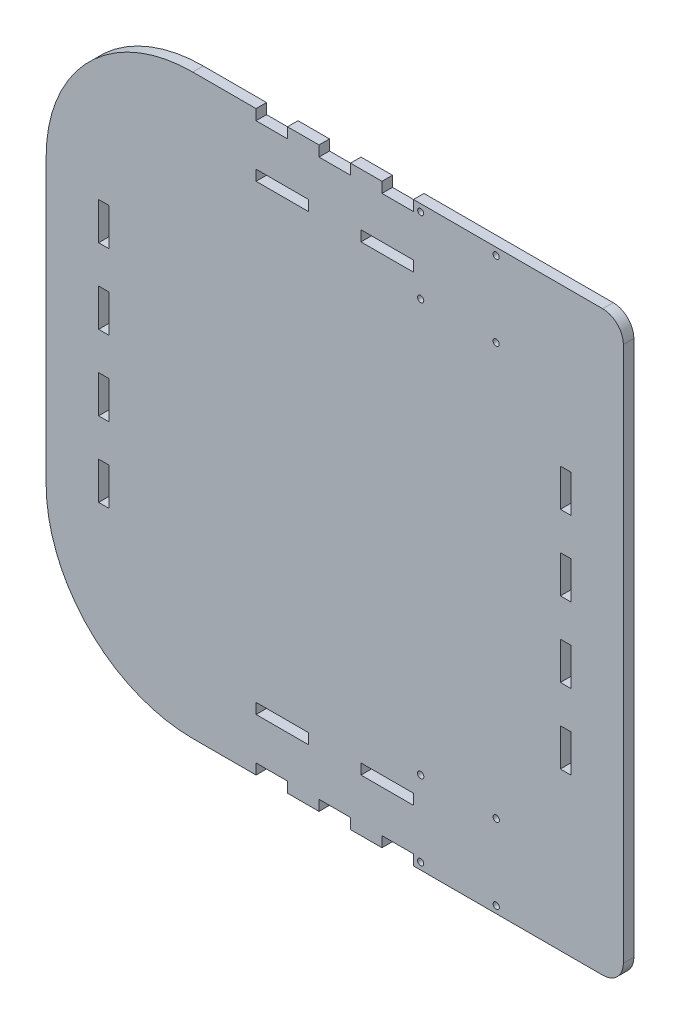
from build123d import *

# Parameters (mm, degrees)
SKETCH1_W           = 279.4
SKETCH1_H           = 279.4
BOSS_EXTRUDE1_DEPTH = 5.08
FILLET1_R           = 70.96
FILLET2_R           = 70.960000066
FILLET3_R           = 10
FILLET4_R           = 10
SKETCH2_W           = 25.4
SKETCH2_H           = 5.08
CUT_EXTRUDE1_DEPTH  = 7.62
SKETCH3_W           = 15.24
SKETCH3_H           = 5.08
CUT_EXTRUDE2_DEPTH  = 5.08
SKETCH4_W           = 25.4
SKETCH4_H           = 5.08
SKETCH4_W_2         = 15.24
CUT_EXTRUDE3_DEPTH  = 5.08
SKETCH5_W           = 5.08
SKETCH5_H           = 18.142857143
CUT_EXTRUDE4_DEPTH  = 5.08
SKETCH9_R           = 1.521747373
SKETCH9_R_2         = 1.52437788
SKETCH9_R_3         = 1.483080804
SKETCH9_R_4         = 1.509853377
CUT_EXTRUDE5_DEPTH  = 5.08
SKETCH10_R          = 1.496375704
SKETCH10_R_2        = 1.496038234
SKETCH10_R_3        = 1.499292219
SKETCH10_R_4        = 1.440705467
CUT_EXTRUDE6_DEPTH  = 5.08


with BuildPart() as part:
    # Sketch1 → Boss-Extrude1 (new body)
    with BuildSketch(Plane.XY):
        Rectangle(SKETCH1_W, SKETCH1_H)
    extrude(amount=BOSS_EXTRUDE1_DEPTH)

    # Fillet1
    fillet1_edges = [part.edges().sort_by_distance(p)[0] for p in [
        (-139.7, 139.7, 2.54),
    ]]
    fillet(fillet1_edges, radius=FILLET1_R)

    # Fillet2
    fillet2_edges = [part.edges().sort_by_distance(p)[0] for p in [
        (-139.7, -139.7, 2.54),
    ]]
    fillet(fillet2_edges, radius=FILLET2_R)

    # Fillet3
    fillet3_edges = [part.edges().sort_by_distance(p)[0] for p in [
        (139.7, 139.7, 2.54),
    ]]
    fillet(fillet3_edges, radius=FILLET3_R)

    # Fillet4
    fillet4_edges = [part.edges().sort_by_distance(p)[0] for p in [
        (139.7, -139.7, 2.54),
    ]]
    fillet(fillet4_edges, radius=FILLET4_R)

    # Sketch2 → Cut-Extrude1 (cut)
    with BuildSketch(Plane.XY.offset(5.08)):
        with Locations((-25.4, -111.76)):
            Rectangle(SKETCH2_W, SKETCH2_H)
        with Locations((25.4, -111.76)):
            Rectangle(SKETCH2_W, SKETCH2_H)
    extrude(amount=-CUT_EXTRUDE1_DEPTH, mode=Mode.SUBTRACT)

    # Sketch3 → Cut-Extrude2 (cut)
    with BuildSketch(Plane.XY.offset(5.08)):
        with Locations((-30.48, -137.16)):
            Rectangle(SKETCH3_W, SKETCH3_H)
        with Locations((0, -137.16)):
            Rectangle(SKETCH3_W, SKETCH3_H)
        with Locations((30.48, -137.16)):
            Rectangle(SKETCH3_W, SKETCH3_H)
    extrude(amount=-CUT_EXTRUDE2_DEPTH, mode=Mode.SUBTRACT)

    # Sketch4 → Cut-Extrude3 (cut)
    with BuildSketch(Plane.XY.offset(5.08)):
        with Locations((-25.4, 111.76)):
            Rectangle(SKETCH4_W, SKETCH4_H)
        with Locations((25.4, 111.76)):
            Rectangle(SKETCH4_W, SKETCH4_H)
        with Locations((-30.48, 137.16)):
            Rectangle(SKETCH4_W_2, SKETCH4_H)
        with Locations((0, 137.16)):
            Rectangle(SKETCH4_W_2, SKETCH4_H)
        with Locations((30.48, 137.16)):
            Rectangle(SKETCH4_W_2, SKETCH4_H)
    extrude(amount=-CUT_EXTRUDE3_DEPTH, mode=Mode.SUBTRACT)

    # Sketch5 → Cut-Extrude4 (cut)
    with BuildSketch(Plane(origin=(0, 0, 0), x_dir=(-1, 0, 0), z_dir=(0, 0, -1))):
        with Locations((111.76, -54.428571429)):
            Rectangle(SKETCH5_W, SKETCH5_H)
        with Locations((111.76, -18.142857143)):
            Rectangle(SKETCH5_W, SKETCH5_H)
        with Locations((111.76, 18.142857143)):
            Rectangle(SKETCH5_W, SKETCH5_H)
        with Locations((111.76, 54.428571429)):
            Rectangle(SKETCH5_W, SKETCH5_H)
        with Locations((-111.76, -54.428571429)):
            Rectangle(SKETCH5_W, SKETCH5_H)
        with Locations((-111.76, -18.142857143)):
            Rectangle(SKETCH5_W, SKETCH5_H)
        with Locations((-111.76, 18.142857143)):
            Rectangle(SKETCH5_W, SKETCH5_H)
        with Locations((-111.76, 54.428571429)):
            Rectangle(SKETCH5_W, SKETCH5_H)
    extrude(amount=-CUT_EXTRUDE4_DEPTH, mode=Mode.SUBTRACT)

    # Sketch9 → Cut-Extrude5 (cut)
    with BuildSketch(Plane(origin=(0, 0, 0), x_dir=(-1, 0, 0), z_dir=(0, 0, -1))):
        with Locations((-78.174292247, -99.783948619)):
            Circle(SKETCH9_R)
        with Locations((-41.5890041, -99.783948619)):
            Circle(SKETCH9_R_2)
        with Locations((-41.5890041, -136.30594042)):
            Circle(SKETCH9_R_3)
        with Locations((-78.174292247, -136.30594042)):
            Circle(SKETCH9_R_4)
    extrude(amount=-CUT_EXTRUDE5_DEPTH, mode=Mode.SUBTRACT)

    # Sketch10 → Cut-Extrude6 (cut)
    with BuildSketch(Plane(origin=(0, 0, 0), x_dir=(-1, 0, 0), z_dir=(0, 0, -1))):
        with Locations((-78.112727159, 136.214508439)):
            Circle(SKETCH10_R)
        with Locations((-78.112727159, 99.715329187)):
            Circle(SKETCH10_R_2)
        with Locations((-41.590577287, 99.715329187)):
            Circle(SKETCH10_R_3)
        with Locations((-41.590577287, 136.214508439)):
            Circle(SKETCH10_R_4)
    extrude(amount=-CUT_EXTRUDE6_DEPTH, mode=Mode.SUBTRACT)


solid = part.part
